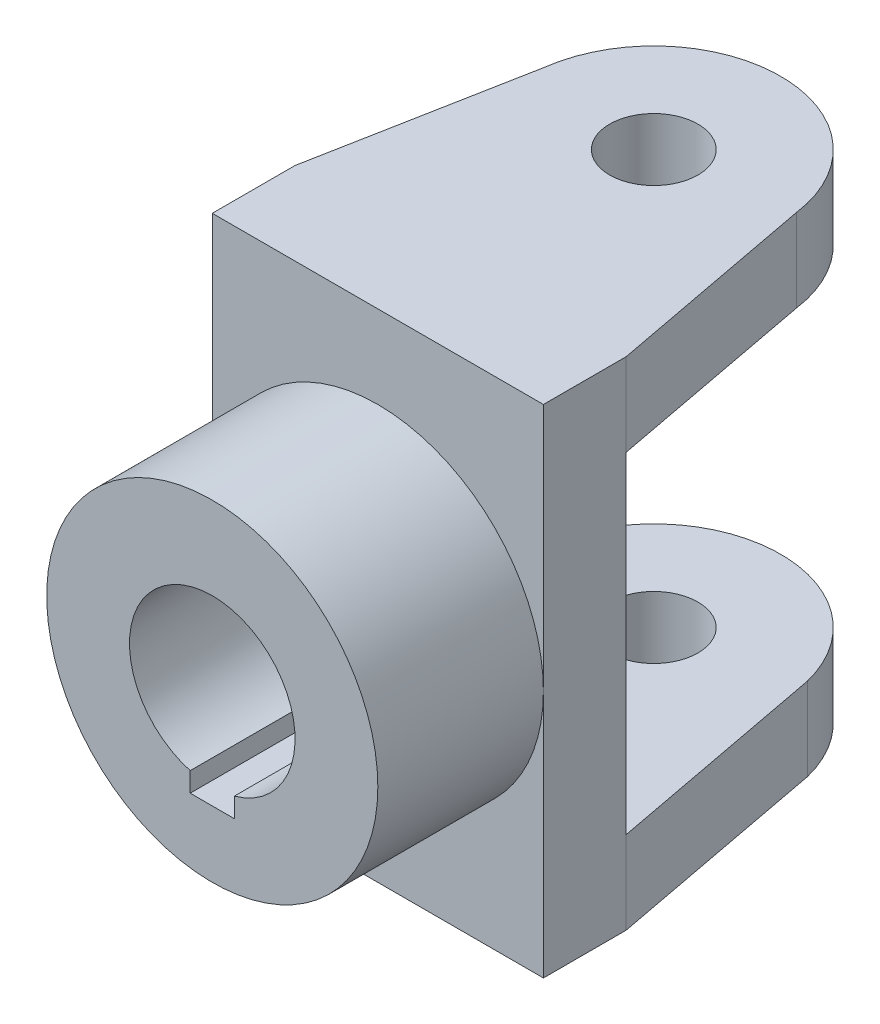
from build123d import *

# Parameters (mm, degrees)
SKETCH1_W           = 60
SKETCH1_H           = 90
BOSS_EXTRUDE1_DEPTH = 15
SKETCH2_R           = 30
SKETCH2_R_2         = 15
BOSS_EXTRUDE2_DEPTH = 30
CUT_EXTRUDE1_START  = -30
CUT_EXTRUDE1_DEPTH  = 30
SKETCH4_R           = 8
BOSS_EXTRUDE4_DEPTH = 15
BOSS_EXTRUDE5_START = -15
SKETCH8_R           = 8
BOSS_EXTRUDE5_DEPTH = 15


with BuildPart() as part:
    # Sketch1 → Boss-Extrude1 (new body)
    with BuildSketch(Plane.XY):
        Rectangle(SKETCH1_W, SKETCH1_H)
    extrude(amount=BOSS_EXTRUDE1_DEPTH)

    # Sketch2 → Boss-Extrude2 (add)
    with BuildSketch(Plane.XY.offset(15)):
        Circle(SKETCH2_R)
        Circle(SKETCH2_R_2, mode=Mode.SUBTRACT)
    extrude(amount=BOSS_EXTRUDE2_DEPTH)

    # Sketch3 → Cut-Extrude1 (cut)
    with BuildSketch(Plane.XY.offset(45).offset(CUT_EXTRUDE1_START)):
        with BuildLine():
            Line((-4, -18), (4, -18))
            Line((4, -18), (4, -14.456832295))
            ThreePointArc((4, -14.456832295), (0, 15), (-4, -14.456832295))
            Line((-4, -14.456832295), (-4, -18))
        make_face()
    extrude(amount=CUT_EXTRUDE1_DEPTH, mode=Mode.SUBTRACT)

    # Sketch4 → Boss-Extrude4 (add)
    with BuildSketch(Plane(origin=(0, 45, 0), x_dir=(1, 0, 0), z_dir=(0, 1, 0))):
        with BuildLine():
            Line((-30, 0), (-22.79450882, 38.067632254))
            ThreePointArc((-22.79450882, 38.067632254), (0, 58), (22.79450882, 38.067632254))
            Line((22.79450882, 38.067632254), (30, 0))
            Line((30, 0), (-30, 0))
        make_face()
        with Locations(Location((0, 35, 0), (0, 0, 270))):
            Circle(SKETCH4_R, mode=Mode.SUBTRACT)
    extrude(amount=-BOSS_EXTRUDE4_DEPTH)

    # Sketch8 → Boss-Extrude5 (add)
    with BuildSketch(Plane.XZ.offset(45).offset(BOSS_EXTRUDE5_START)):
        with BuildLine():
            Line((30, 0), (-30, 0))
            Line((-30, 0), (-22.800687568, -38.021364997))
            Line((-22.800687568, -38.021364997), (-22.326909292, -40.523506265))
            ThreePointArc((-22.326909292, -40.523506265), (0, -58), (22.326909292, -40.523506265))
            Line((22.326909292, -40.523506265), (22.800687568, -38.021364997))
            Line((22.800687568, -38.021364997), (30, 0))
        make_face()
        with Locations(Location((0, -35, 0), (0, 0, 90))):
            Circle(SKETCH8_R, mode=Mode.SUBTRACT)
    extrude(amount=BOSS_EXTRUDE5_DEPTH)


solid = part.part
